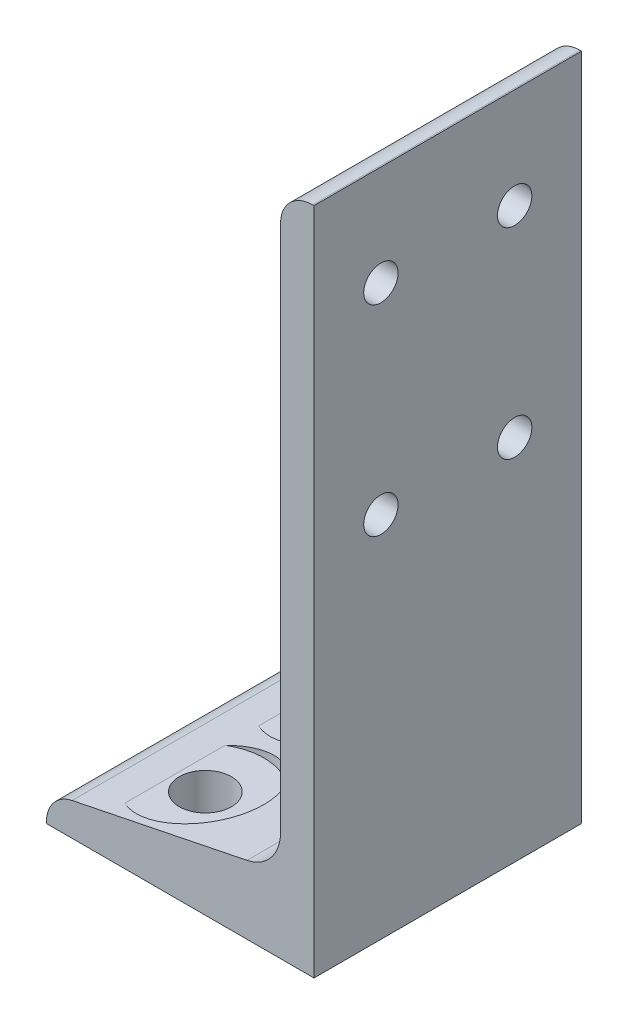
from build123d import *

# Parameters (mm, degrees)
EXTRUDE1_DEPTH     = 25.4
SKETCH11_R         = 11.1125
CUT_EXTRUDE4_DEPTH = 133.202058985
SKETCH12_R         = 4.953
CUT_EXTRUDE5_DEPTH = 133.202058985
SKETCH13_R         = 3.2639
CUT_EXTRUDE6_DEPTH = 137.930502446


with BuildPart() as part:
    # Sketch1 → Extrude1 (new, symmetric)
    with BuildSketch(Plane.XY):
        with BuildLine():
            Line((0, 127), (0, 0))
            Line((0, 0), (-50.8, 0))
            Line((-50.8, 0), (-50.8, 0.254))
            ThreePointArc((-50.8, 0.254), (-49.425137622, 4.11043301), (-45.920710119, 6.227343493))
            Line((-45.920710119, 6.227343493), (-12.703242032, 12.993408361))
            ThreePointArc((-12.703242032, 12.993408361), (-8.140185388, 15.74980222), (-6.35, 20.771199368))
            Line((-6.35, 20.771199368), (-6.35, 120.904))
            ThreePointArc((-6.35, 120.904), (-4.564522938, 125.214522938), (-0.254, 127))
            Line((-0.254, 127), (0, 127))
        make_face()
    extrude(amount=EXTRUDE1_DEPTH, both=True)

    # Sketch11 → Cut-Extrude4 (cut, through all)
    with BuildSketch(Plane(origin=(0, 7.62, 0), x_dir=(-1, 0, 0), z_dir=(0, 1, 0))):
        with Locations((33.3248, -12.7)):
            Circle(SKETCH11_R)
        with Locations((33.3248, 12.7)):
            Circle(SKETCH11_R)
    extrude(amount=CUT_EXTRUDE4_DEPTH, mode=Mode.SUBTRACT)

    # Sketch12 → Cut-Extrude5 (cut, through all)
    with BuildSketch(Plane(origin=(0, 7.62, 0), x_dir=(-1, 0, 0), z_dir=(0, 1, 0))):
        with Locations(Location((33.3248, 12.7, 0), (0, 0, 90))):
            Circle(SKETCH12_R)
        with Locations(Location((33.3248, -12.7, 0), (0, 0, 90))):
            Circle(SKETCH12_R)
    extrude(amount=-CUT_EXTRUDE5_DEPTH, mode=Mode.SUBTRACT)

    # Sketch13 → Cut-Extrude6 (cut, through all)
    with BuildSketch(Plane.ZY.offset(6.35)):
        with Locations(Location((-12.7, 69.85, 0), (0, 0, 270))):
            Circle(SKETCH13_R)
        with Locations(Location((-12.7, 107.95, 0), (0, 0, 270))):
            Circle(SKETCH13_R)
        with Locations(Location((12.7, 107.95, 0), (0, 0, 270))):
            Circle(SKETCH13_R)
        with Locations(Location((12.7, 69.85, 0), (0, 0, 270))):
            Circle(SKETCH13_R)
    extrude(amount=-CUT_EXTRUDE6_DEPTH, mode=Mode.SUBTRACT)


solid = part.part
